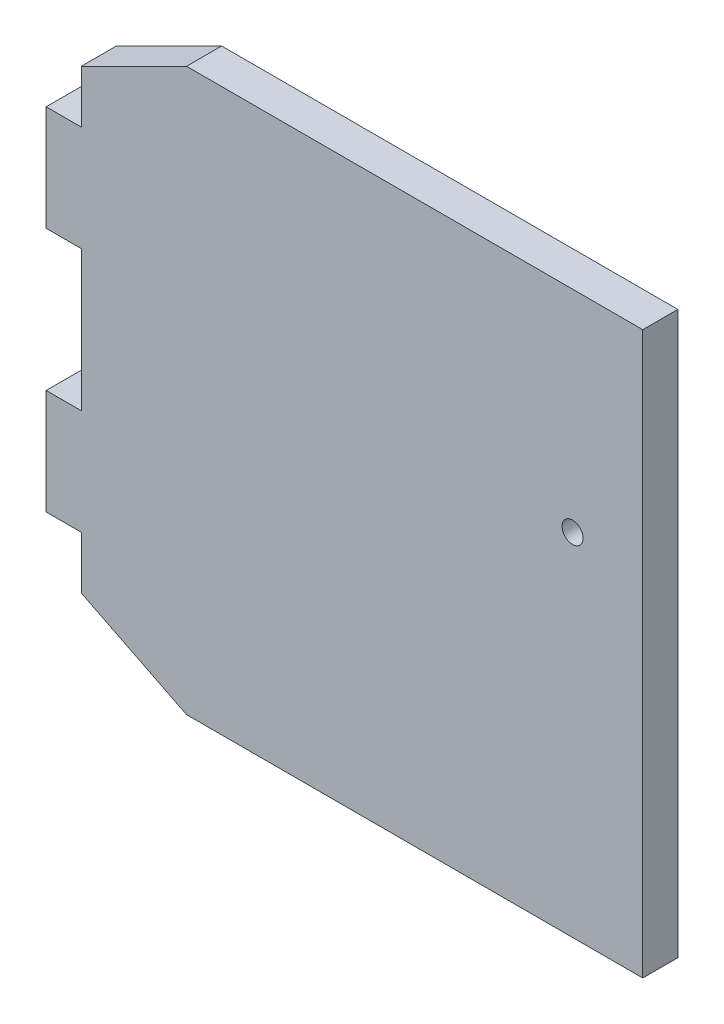
from build123d import *

# Parameters (mm, degrees)
BOSS_EXTRUDE1_DEPTH = 5
SKETCH3_W           = 5
SKETCH3_H           = 15
BOSS_EXTRUDE2_DEPTH = 5
CUT_EXTRUDE2_DEPTH  = 5
SKETCH5_R           = 1.5
CUT_EXTRUDE3_DEPTH  = 5


with BuildPart() as part:
    # Sketch1 → Boss-Extrude1 (new body)
    with BuildSketch(Plane.XY):
        Polygon((0, 31.783783784), (10, 31.783783784), (40, 31.783783784), (40, 21.783783784), (40, -48.216216216), (-40, -48.216216216), (-40, 31.783783784), align=None)
    extrude(amount=BOSS_EXTRUDE1_DEPTH)

    # Sketch3 → Boss-Extrude2 (add)
    with BuildSketch(Plane.ZY.offset(40)):
        with Locations((2.5, 9.283783784)):
            Rectangle(SKETCH3_W, SKETCH3_H)
        with Locations((2.5, -25.716216216)):
            Rectangle(SKETCH3_W, SKETCH3_H)
    extrude(amount=BOSS_EXTRUDE2_DEPTH)

    # Sketch4 → Cut-Extrude2 (cut)
    with BuildSketch(Plane.XY.offset(5)):
        Polygon((-40, 31.783783784), (-25, 31.783783784), (-40, 24.283783784), align=None)
        Polygon((-40, -48.216216216), (-40, -40.716216216), (-25, -48.216216216), align=None)
    extrude(amount=-CUT_EXTRUDE2_DEPTH, mode=Mode.SUBTRACT)

    # Sketch5 → Cut-Extrude3 (cut)
    with BuildSketch(Plane.XY.offset(5)):
        with Locations((30, 1.783783784)):
            Circle(SKETCH5_R)
    extrude(amount=-CUT_EXTRUDE3_DEPTH, mode=Mode.SUBTRACT)


solid = part.part
